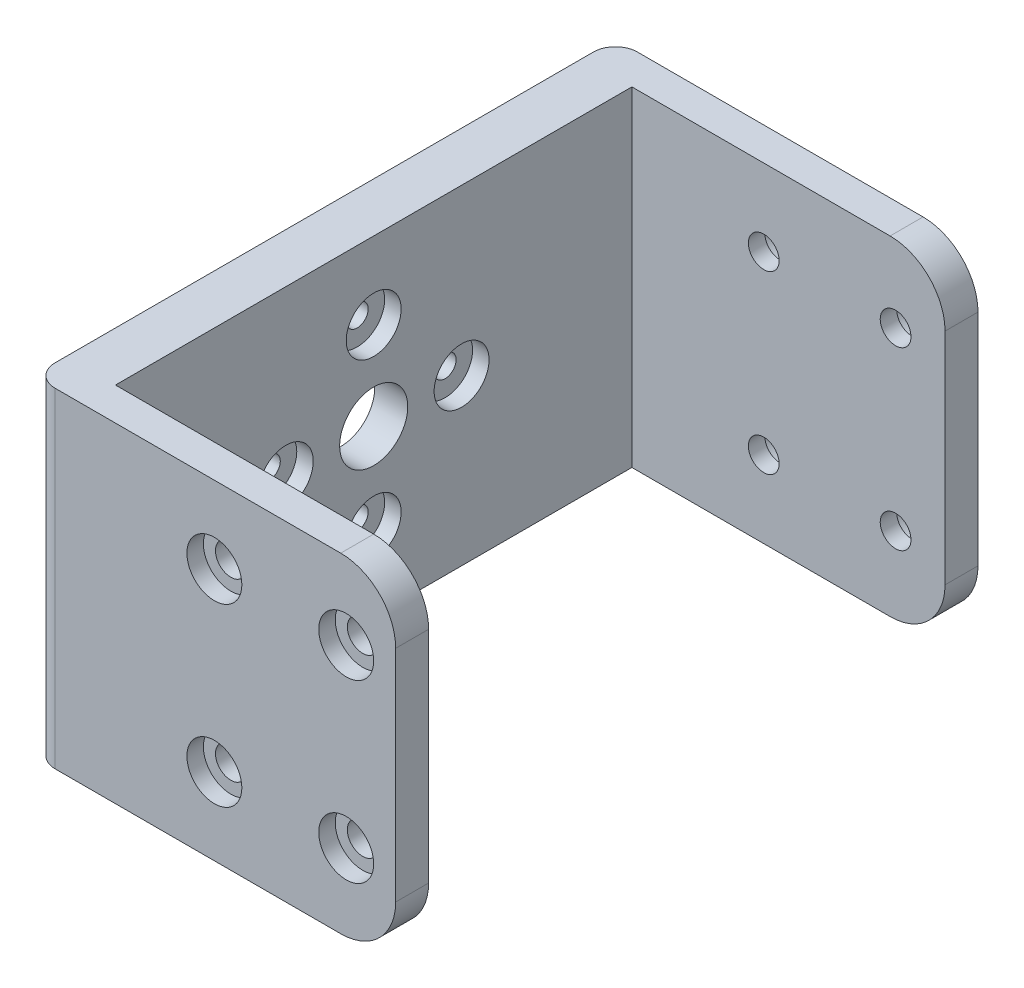
from build123d import *

# Parameters (mm, degrees)
BOSS_EXTRUDE1_DEPTH = 30
SKETCH2_R           = 1.4
CUT_EXTRUDE1_DEPTH  = 90.675732638
SKETCH3_R           = 2.5
CUT_EXTRUDE2_DEPTH  = 1.5
SKETCH5_R           = 11.4
CUT_EXTRUDE4_DEPTH  = 1.5
CUT_EXTRUDE7_START  = -1.5
SKETCH8_R           = 2.5
CUT_EXTRUDE7_DEPTH  = 1.5
SKETCH6_R           = 3.1
SKETCH6_R_2         = 1
CUT_EXTRUDE5_DEPTH  = 57.184338839
FILLET1_R           = 5
FILLET2_R           = 2
SKETCH7_R           = 2.5
CUT_EXTRUDE6_DEPTH  = 1.5


with BuildPart() as part:
    # Sketch1 → Boss-Extrude1 (new body)
    with BuildSketch(Plane(origin=(0, 0, 0), x_dir=(1, 0, 0), z_dir=(0, 1, 0))):
        Polygon((65.823529412, -35.558823529), (65.823529412, -32.558823529), (37.323529412, -32.558823529), (37.323529412, 14.441176471), (65.823529412, 14.441176471), (65.823529412, 17.441176471), (32.823529412, 17.441176471), (32.823529412, -35.558823529), align=None)
    extrude(amount=BOSS_EXTRUDE1_DEPTH)

    # Sketch2 → Cut-Extrude1 (cut, through all)
    with BuildSketch(Plane(origin=(0, 0, -17.441176471), x_dir=(-1, 0, 0), z_dir=(0, 0, -1))):
        with Locations((-61.323529412, 7)):
            Circle(SKETCH2_R)
        with Locations((-49.323529412, 7)):
            Circle(SKETCH2_R)
        with Locations((-49.323529412, 23)):
            Circle(SKETCH2_R)
        with Locations((-61.323529412, 23)):
            Circle(SKETCH2_R)
    extrude(amount=-CUT_EXTRUDE1_DEPTH, mode=Mode.SUBTRACT)

    # Sketch3 → Cut-Extrude2 (cut)
    with BuildSketch(Plane(origin=(0, 0, -17.441176471), x_dir=(-1, 0, 0), z_dir=(0, 0, -1))):
        with Locations((-61.323529412, 7)):
            Circle(SKETCH3_R)
        with Locations((-49.323529412, 7)):
            Circle(SKETCH3_R)
        with Locations((-49.323529412, 23)):
            Circle(SKETCH3_R)
        with Locations((-61.323529412, 23)):
            Circle(SKETCH3_R)
    extrude(amount=-CUT_EXTRUDE2_DEPTH, mode=Mode.SUBTRACT)

    # Sketch5 → Cut-Extrude4 (cut)
    with BuildSketch(Plane.ZY.offset(-32.823529412)):
        with Locations((9.058823529, 15)):
            Circle(SKETCH5_R)
    extrude(amount=-CUT_EXTRUDE4_DEPTH, mode=Mode.SUBTRACT)

    # Sketch8 → Cut-Extrude7 (cut)
    with BuildSketch(Plane.XY.offset(35.558823529).offset(CUT_EXTRUDE7_START)):
        with Locations(Location((49.323529412, 23, 0), (0, 0, 180))):
            Circle(SKETCH8_R)
        with Locations(Location((61.323529412, 23, 0), (0, 0, 180))):
            Circle(SKETCH8_R)
        with Locations(Location((49.323529412, 7, 0), (0, 0, 180))):
            Circle(SKETCH8_R)
        with Locations(Location((61.323529412, 7, 0), (0, 0, 180))):
            Circle(SKETCH8_R)
    extrude(amount=CUT_EXTRUDE7_DEPTH, mode=Mode.SUBTRACT)

    # Sketch6 → Cut-Extrude5 (cut, through all)
    with BuildSketch(Plane.ZY.offset(-34.323529412)):
        with Locations((9.058823529, 15)):
            Circle(SKETCH6_R)
        with Locations((1.058823529, 15)):
            Circle(SKETCH6_R_2)
        with Locations((9.058823529, 23)):
            Circle(SKETCH6_R_2)
        with Locations((17.058823529, 15)):
            Circle(SKETCH6_R_2)
        with Locations((9.058823529, 7)):
            Circle(SKETCH6_R_2)
    extrude(amount=-CUT_EXTRUDE5_DEPTH, mode=Mode.SUBTRACT)

    # Fillet1
    fillet1_edges = [part.edges().sort_by_distance(p)[0] for p in [
        (65.823529412, 0, 34.058823529),
        (65.823529412, 30, -15.941176471),
        (65.823529412, 30, 34.058823529),
        (65.823529412, 0, -15.941176471),
    ]]
    fillet(fillet1_edges, radius=FILLET1_R)

    # Fillet2
    fillet2_edges = [part.edges().sort_by_distance(p)[0] for p in [
        (32.823529412, 15, 35.558823529),
        (32.823529412, 15, -17.441176471),
    ]]
    fillet(fillet2_edges, radius=FILLET2_R)

    # Sketch7 → Cut-Extrude6 (cut)
    with BuildSketch(Plane(origin=(37.323529412, 0, 0), x_dir=(0, 0, -1), z_dir=(1, 0, 0))):
        with Locations((-17.058823529, 15)):
            Circle(SKETCH7_R)
        with Locations((-9.058823529, 23)):
            Circle(SKETCH7_R)
        with Locations((-1.058823529, 15)):
            Circle(SKETCH7_R)
        with Locations((-9.058823529, 7)):
            Circle(SKETCH7_R)
    extrude(amount=-CUT_EXTRUDE6_DEPTH, mode=Mode.SUBTRACT)


solid = part.part
